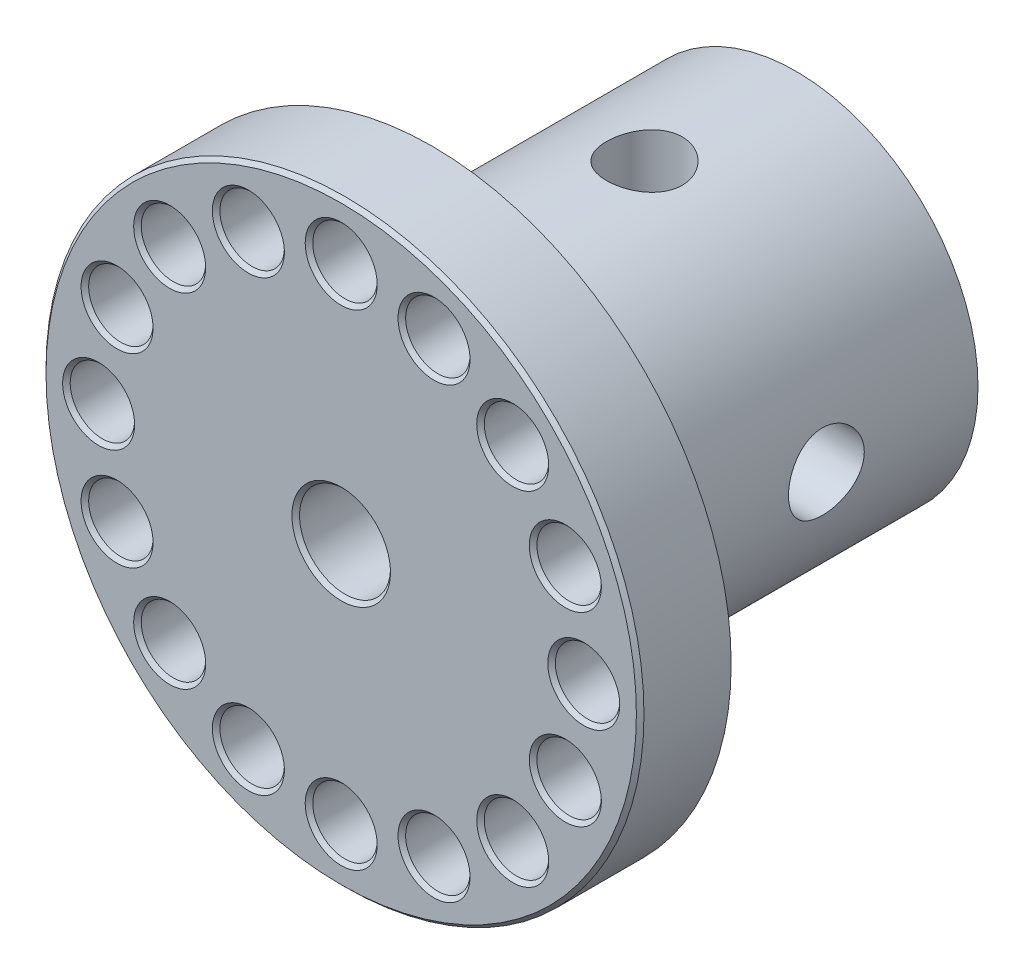
from build123d import *

# Parameters (mm, degrees)
SKETCH2_R          = 3.3734375
CUT_EXTRUDE1_DEPTH = 66.024682125
CIRPATTERN1_COUNT  = 16
SKETCH4_R          = 2.38125
CUT_EXTRUDE2_DEPTH = 66.024682125
CUT_EXTRUDE3_START = -31.75
CUT_EXTRUDE3_DEPTH = 31.75
SKETCH5_R          = 3.96875
CUT_EXTRUDE4_DEPTH = 66.024682199
CIRPATTERN2_COUNT  = 2
CIRPATTERN2_ANGLE  = 90
CHAMFER1_SIZE      = 0.396875


with BuildPart() as part:
    # Sketch1 → Base-Revolve (revolve)
    with BuildSketch(Plane(origin=(0, 0, 0), x_dir=(0, 0, -1), z_dir=(1, 0, 0)), mode=Mode.PRIVATE) as base_revolve_sk:
        with BuildLine():
            Line((0, 31.3055), (0, 4.7625))
            Line((0, 4.7625), (15.875, 4.7625))
            Line((15.875, 4.7625), (15.875, 7.0231))
            Line((15.875, 7.0231), (47.625, 7.0231))
            Line((47.625, 7.0231), (47.625, 19.05))
            Line((47.625, 19.05), (12.7, 19.05))
            ThreePointArc((12.7, 19.05), (10.45493597, 19.97993597), (9.525, 22.225))
            Line((9.525, 22.225), (9.525, 31.3055))
            Line((9.525, 31.3055), (0, 31.3055))
        make_face()
    revolve(base_revolve_sk.sketch.rotate(Axis((0, 0, 8.5328125), (0, 0, -1)), 90), axis=Axis((0, 0, 8.5328125), (0, 0, -1)))

    # Sketch2 → Cut-Extrude1 (cut, through all)
    with BuildSketch(Plane.XY):
        with Locations((25.4, 0)):
            Circle(SKETCH2_R)
    cut_extrude1 = extrude(amount=-CUT_EXTRUDE1_DEPTH, mode=Mode.SUBTRACT)

    # CirPattern1: Cut-Extrude1 ×16 about axis
    cirpattern1_axis = Axis((0, 0, 0), (0, 0, 1))
    for i in range(1, CIRPATTERN1_COUNT):
        add(cut_extrude1.rotate(cirpattern1_axis, i * 360 / CIRPATTERN1_COUNT), mode=Mode.SUBTRACT)

    # Sketch4 → Cut-Extrude2 (cut, through all)
    with BuildSketch(Plane(origin=(0, 0, 0), x_dir=(1, 0, 0), z_dir=(0, 1, 0))):
        with Locations(Location((0, 15.875, 0), (0, 0, 90))):
            Circle(SKETCH4_R)
    extrude(amount=CUT_EXTRUDE2_DEPTH, mode=Mode.SUBTRACT)

    # Sketch3 → Cut-Extrude3 (cut)
    with BuildSketch(Plane(origin=(0, 0, -47.625), x_dir=(-1, 0, 0), z_dir=(0, 0, -1)).offset(CUT_EXTRUDE3_START)):
        with BuildLine():
            Line((-2.54, 9.3599), (2.54, 9.3599))
            Line((2.54, 9.3599), (2.54, 6.547696817))
            ThreePointArc((2.54, 6.547696817), (0, 7.0231), (-2.54, 6.547696817))
            Line((-2.54, 6.547696817), (-2.54, 9.3599))
        make_face()
    extrude(amount=CUT_EXTRUDE3_DEPTH, mode=Mode.SUBTRACT)

    # Sketch5 → Cut-Extrude4 (cut, through all)
    with BuildSketch(Plane(origin=(0, 0, 0), x_dir=(1, 0, 0), z_dir=(0, 1, 0))):
        with Locations(Location((0, 31.75, 0), (0, 0, 90))):
            Circle(SKETCH5_R)
    cut_extrude4 = extrude(amount=CUT_EXTRUDE4_DEPTH, mode=Mode.SUBTRACT)

    # CirPattern2: Cut-Extrude4 ×2 about axis
    cirpattern2_axis = Axis((0, 0, -41.4671875), (0, 0, -1))
    for i in range(1, CIRPATTERN2_COUNT):
        add(cut_extrude4.rotate(cirpattern2_axis, i * CIRPATTERN2_ANGLE / (CIRPATTERN2_COUNT - 1)), mode=Mode.SUBTRACT)

    # Chamfer1
    chamfer1_edges = [part.edges().sort_by_distance(p)[0] for p in [
        (8.429200541, -20.349890265, 0),
        (-31.3055, 0, 0),
        (15.57513171, -15.57513171, 0),
        (20.349890265, -8.429200541, 0),
        (22.0265625, 0, 0),
        (20.349890265, 8.429200541, 0),
        (15.57513171, 15.57513171, 0),
        (8.429200541, 20.349890265, 0),
        (0, 22.0265625, 0),
        (-8.429200541, 20.349890265, 0),
        (-15.57513171, 15.57513171, 0),
        (-20.349890265, 8.429200541, 0),
        (-22.0265625, 0, 0),
        (-20.349890265, -8.429200541, 0),
        (-15.57513171, -15.57513171, 0),
        (-8.429200541, -20.349890265, 0),
        (0, -22.0265625, 0),
        (-4.7625, 0, 0),
    ]]
    chamfer(chamfer1_edges, length=CHAMFER1_SIZE)


solid = part.part
